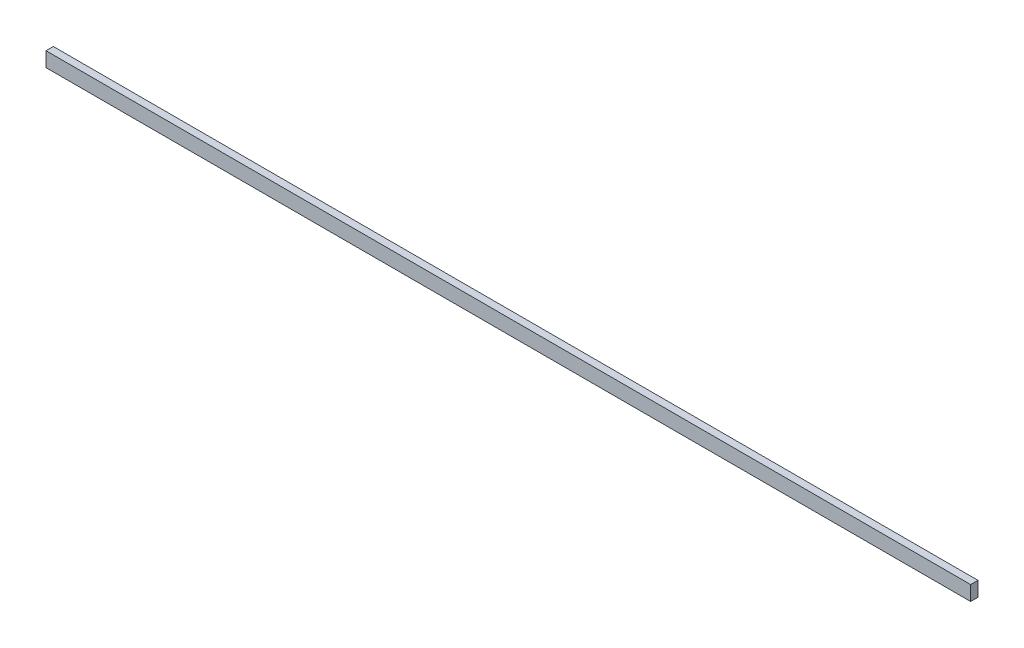
from build123d import *

# Parameters (mm, degrees)
SKETCH1_W           = 630
SKETCH1_H           = 5
BOSS_EXTRUDE1_DEPTH = 10


with BuildPart() as part:
    # Sketch1 → Boss-Extrude1 (new body)
    with BuildSketch(Plane(origin=(0, 0, 0), x_dir=(1, 0, 0), z_dir=(0, 1, 0))):
        with Locations((315, -2.5)):
            Rectangle(SKETCH1_W, SKETCH1_H)
    extrude(amount=BOSS_EXTRUDE1_DEPTH)


solid = part.part
